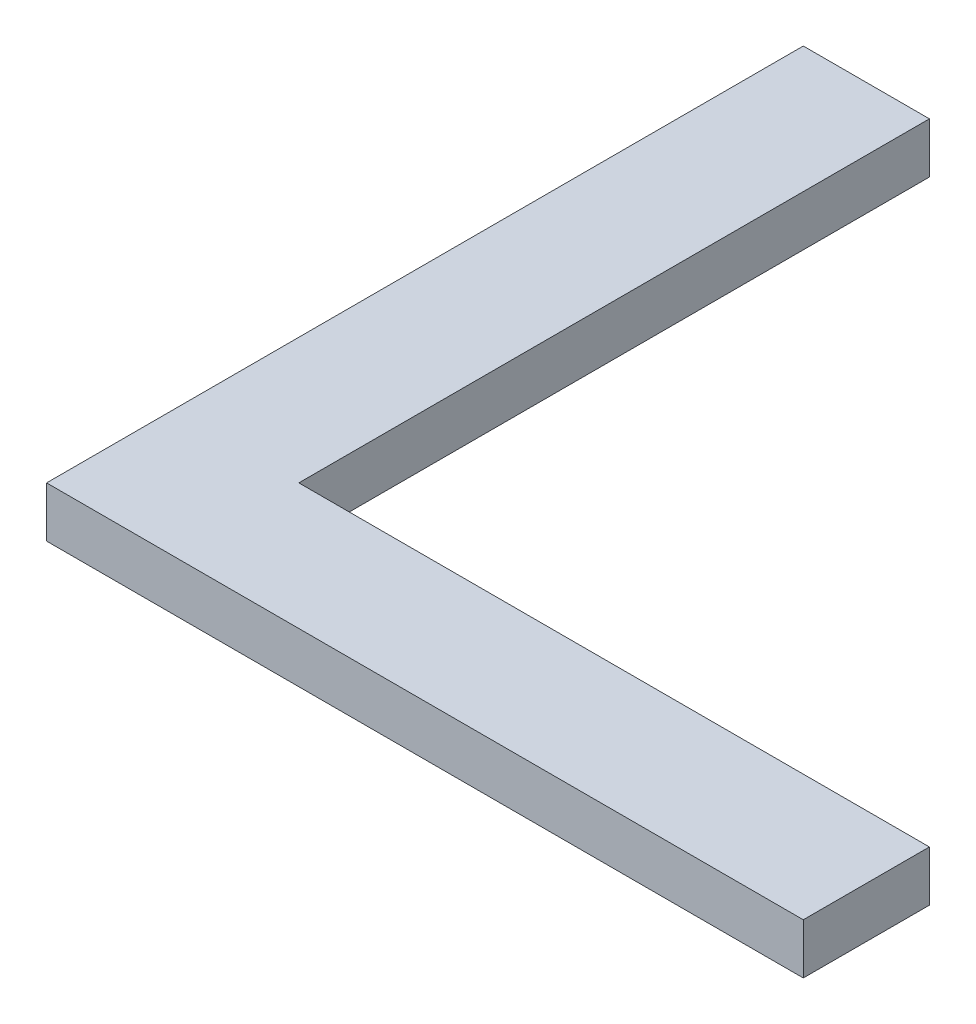
from build123d import *

# Parameters (mm, degrees)
BOSS_EXTRUDE1_DEPTH = 2.54


with BuildPart() as part:
    # Sketch1 → Boss-Extrude1 (new body)
    with BuildSketch(Plane(origin=(0, 0, 0), x_dir=(1, 0, 0), z_dir=(0, 1, 0))):
        Polygon((31.75, 0), (0, 0), (0, 31.75), (-6.35, 31.75), (-6.35, -6.35), (31.75, -6.35), align=None)
    extrude(amount=BOSS_EXTRUDE1_DEPTH)


solid = part.part
